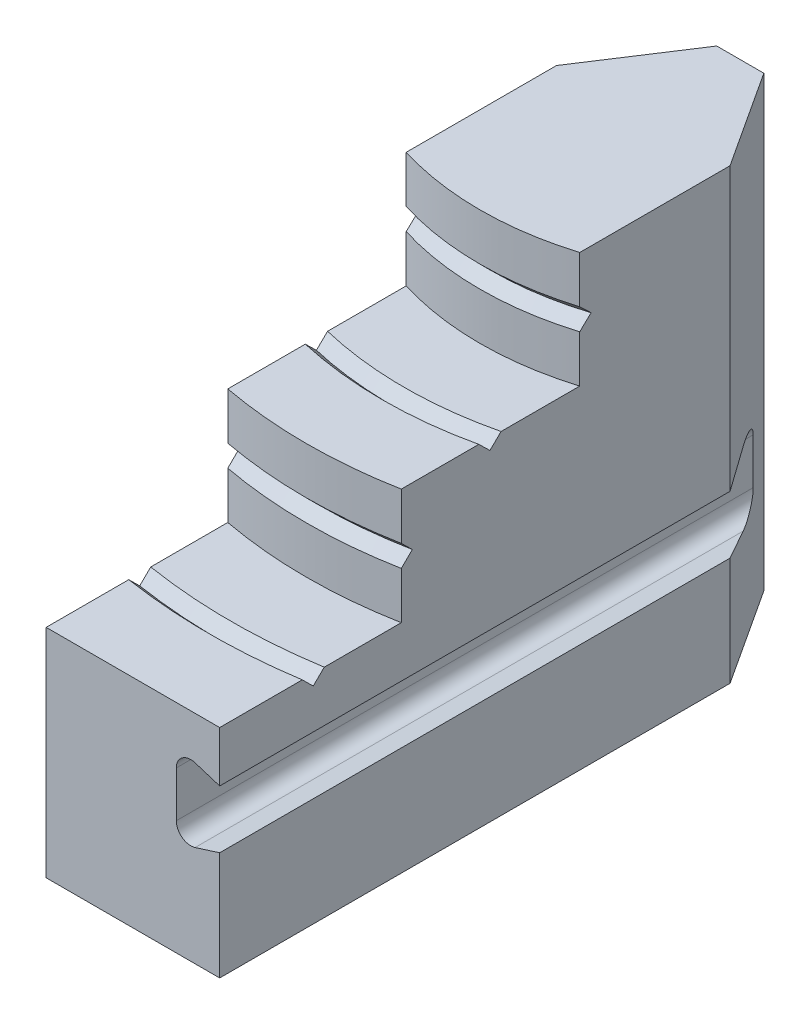
from build123d import *

# Parameters (mm, degrees)
BOSS_EXTRUDE1_DEPTH = 62
CUT_EXTRUDE1_DEPTH  = 106.090437243


with BuildPart() as part:
    # Sketch1 → Boss-Extrude1 (new body)
    with BuildSketch(Plane(origin=(0, 0, 0), x_dir=(1, 0, 0), z_dir=(0, 1, 0))):
        Polygon((-12, 0), (12, 0), (12, 70.583238925), (3.257901851, 84), (-3.257901851, 84), (-12, 70.583238925), align=None)
    extrude(amount=BOSS_EXTRUDE1_DEPTH)

    # Sketch2 → Cut-Revolve4 (revolve, cut)
    with BuildSketch(Plane(origin=(0, 0, 0), x_dir=(0, 0, -1), z_dir=(1, 0, 0))):
        Polygon((48, 55.5), (49.5, 54), (48, 52.5), (48, 46), (37.5, 46), (36, 44.5), (34.5, 46), (24, 46), (24, 39.5), (25.5, 38), (24, 36.5), (24, 30), (13.5, 30), (12, 28.5), (10.5, 30), (-12, 30), (-12, 70), (48, 70), align=None)
    revolve(axis=Axis((0, 0, -89), (0, 1, 0)), mode=Mode.SUBTRACT)

    # Sketch3 → Cut-Extrude1 (cut, through all)
    with BuildSketch(Plane.XY):
        with BuildLine():
            Line((12, 15), (8.601411599, 13.928429193))
            ThreePointArc((8.601411599, 13.928429193), (6.817380703, 14.222973886), (6, 15.835863095))
            Line((6, 15.835863095), (6, 22.164136905))
            ThreePointArc((6, 22.164136905), (6.817380703, 23.777026114), (8.601411599, 24.071570807))
            Line((8.601411599, 24.071570807), (12, 23))
            Line((12, 23), (12, 15))
        make_face()
    extrude(amount=-CUT_EXTRUDE1_DEPTH, mode=Mode.SUBTRACT)


solid = part.part
